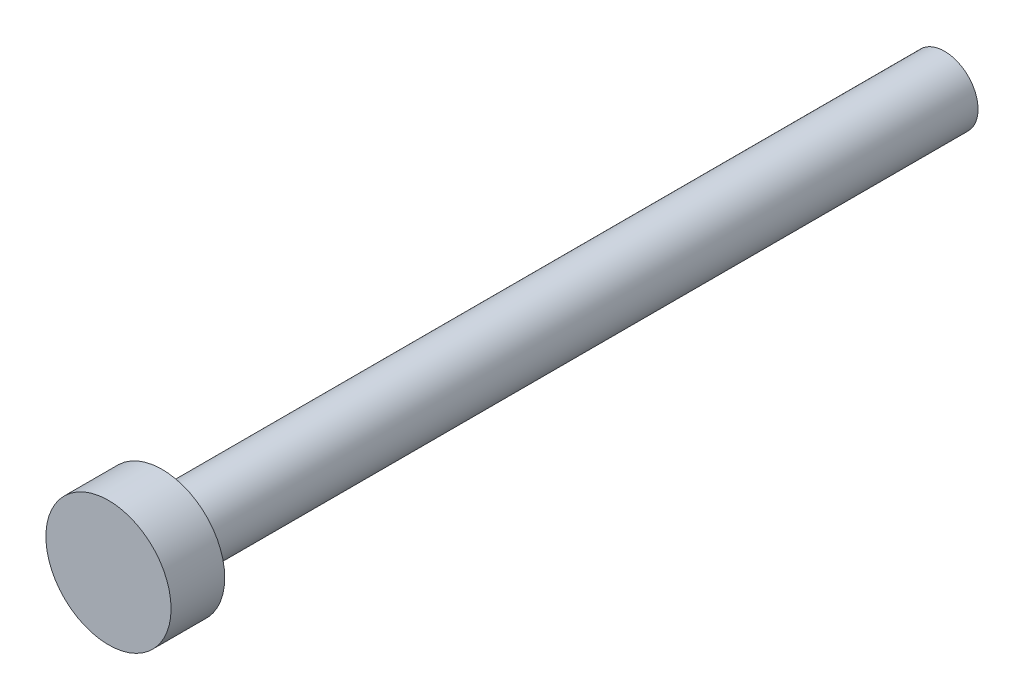
from build123d import *

# Parameters (mm, degrees)
ESQUISSE1_R        = 2.8
BOSS_EXTRU_1_DEPTH = 2.4
ESQUISSE2_R        = 1.5
BOSS_EXTRU_2_DEPTH = 35


with BuildPart() as part:
    # Esquisse1 → Boss.-Extru.1 (new body)
    with BuildSketch(Plane.XY):
        Circle(ESQUISSE1_R)
    extrude(amount=BOSS_EXTRU_1_DEPTH)

    # Esquisse2 → Boss.-Extru.2 (add)
    with BuildSketch(Plane(origin=(0, 0, 0), x_dir=(-1, 0, 0), z_dir=(0, 0, -1))):
        Circle(ESQUISSE2_R)
    extrude(amount=BOSS_EXTRU_2_DEPTH)


solid = part.part
